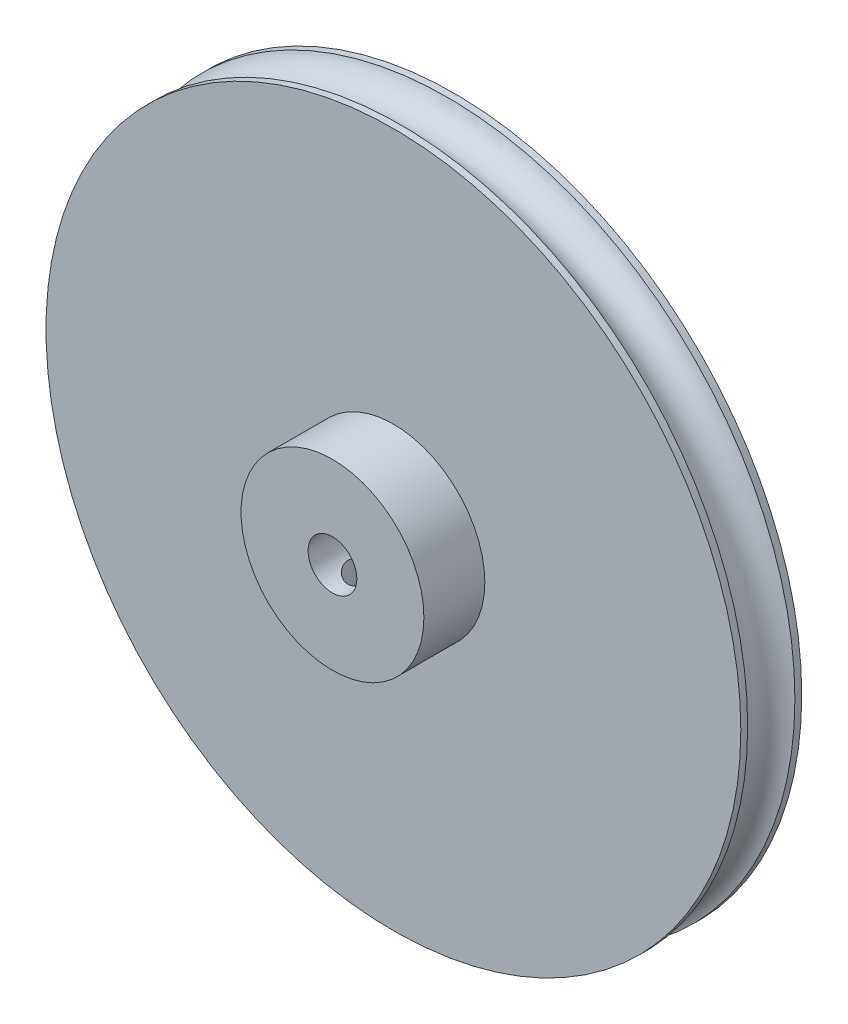
from build123d import *

# Parameters (mm, degrees)
ESQUISSE1_R      = 28.5
EXTRUSION1_DEPTH = 5
ESQUISSE2_R      = 7.5
EXTRUSION2_DEPTH = 5
EXTRUSION3_REACH = 43.527
ESQUISSE3_R      = 2
ESQUISSE12_W     = 1.25
ESQUISSE12_H     = 28.5


with BuildPart() as part:
    # Esquisse1 → Extrusion1 (new body)
    with BuildSketch(Plane.XY):
        Circle(ESQUISSE1_R)
    extrude(amount=-EXTRUSION1_DEPTH)

    # Esquisse2 → Extrusion2 (add)
    with BuildSketch(Plane.XY):
        Circle(ESQUISSE2_R)
    extrude(amount=EXTRUSION2_DEPTH)

    # Esquisse3 → Extrusion3 (cut, up to next)
    with BuildSketch(Plane.XY.offset(5), mode=Mode.PRIVATE) as extrusion3_sk1:
        Circle(ESQUISSE3_R)
    extrusion3_tool1 = extrude(extrusion3_sk1.sketch, amount=-EXTRUSION3_REACH, mode=Mode.PRIVATE) & part.part
    add(extrusion3_tool1.solids().sort_by_distance((0, 0, 5))[0], mode=Mode.SUBTRACT)

    # Esquisse6 → Enlèvement de matière-Révolution3 (revolve, cut)
    with BuildSketch(Plane(origin=(0, 0, 0), x_dir=(1, 0, 0), z_dir=(0, 1, 0)), mode=Mode.PRIVATE) as enl_vement_de_mati_re_r_volution3_sk:
        with BuildLine():
            Line((-29, 4.5), (-31.449617094, 4.5))
            Line((-31.449617094, 4.5), (-31.449617094, 0.5))
            Line((-31.449617094, 0.5), (-29, 0.5))
            ThreePointArc((-29, 0.5), (-27, 2.5), (-29, 4.5))
        make_face()
    revolve(enl_vement_de_mati_re_r_volution3_sk.sketch.rotate(Axis((0, 0, 5), (0, 0, -1)), 180), axis=Axis((0, 0, 5), (0, 0, -1)), mode=Mode.SUBTRACT)

    # Esquisse12 → Trou taraudé M3x0.55 (revolve, cut)
    with BuildSketch(Plane(origin=(0, 0, 2.5), x_dir=(0, 0, 1), z_dir=(1, 0, 0))):
        with Locations((0.625, 14.25)):
            Rectangle(ESQUISSE12_W, ESQUISSE12_H)
    revolve(axis=Axis((0, 6.35, 2.5), (0, -1, 0)), mode=Mode.SUBTRACT)


solid = part.part
